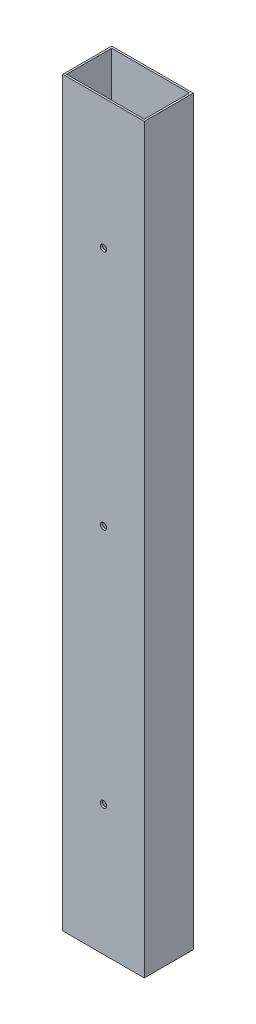
from build123d import *

# Parameters (mm, degrees)
SKETCH1_W           = 50.8
SKETCH1_H           = 30.5
SKETCH1_W_2         = 48.4
SKETCH1_H_2         = 28.1
BOSS_EXTRUDE1_DEPTH = 462
SKETCH2_R           = 2
CUT_EXTRUDE1_DEPTH  = 464.701854644


with BuildPart() as part:
    # Sketch1 → Boss-Extrude1 (new body)
    with BuildSketch(Plane(origin=(0, 0, 0), x_dir=(1, 0, 0), z_dir=(0, 1, 0))):
        Rectangle(SKETCH1_W, SKETCH1_H)
        Rectangle(SKETCH1_W_2, SKETCH1_H_2, mode=Mode.SUBTRACT)
    extrude(amount=BOSS_EXTRUDE1_DEPTH)

    # Sketch2 → Cut-Extrude1 (cut, through all)
    with BuildSketch(Plane(origin=(0, 0, -15.25), x_dir=(-1, 0, 0), z_dir=(0, 0, -1))):
        with Locations((0, 231)):
            Circle(SKETCH2_R)
        with Locations((0, 381)):
            Circle(SKETCH2_R)
        with Locations((0, 81)):
            Circle(SKETCH2_R)
    extrude(amount=-CUT_EXTRUDE1_DEPTH, mode=Mode.SUBTRACT)


solid = part.part
